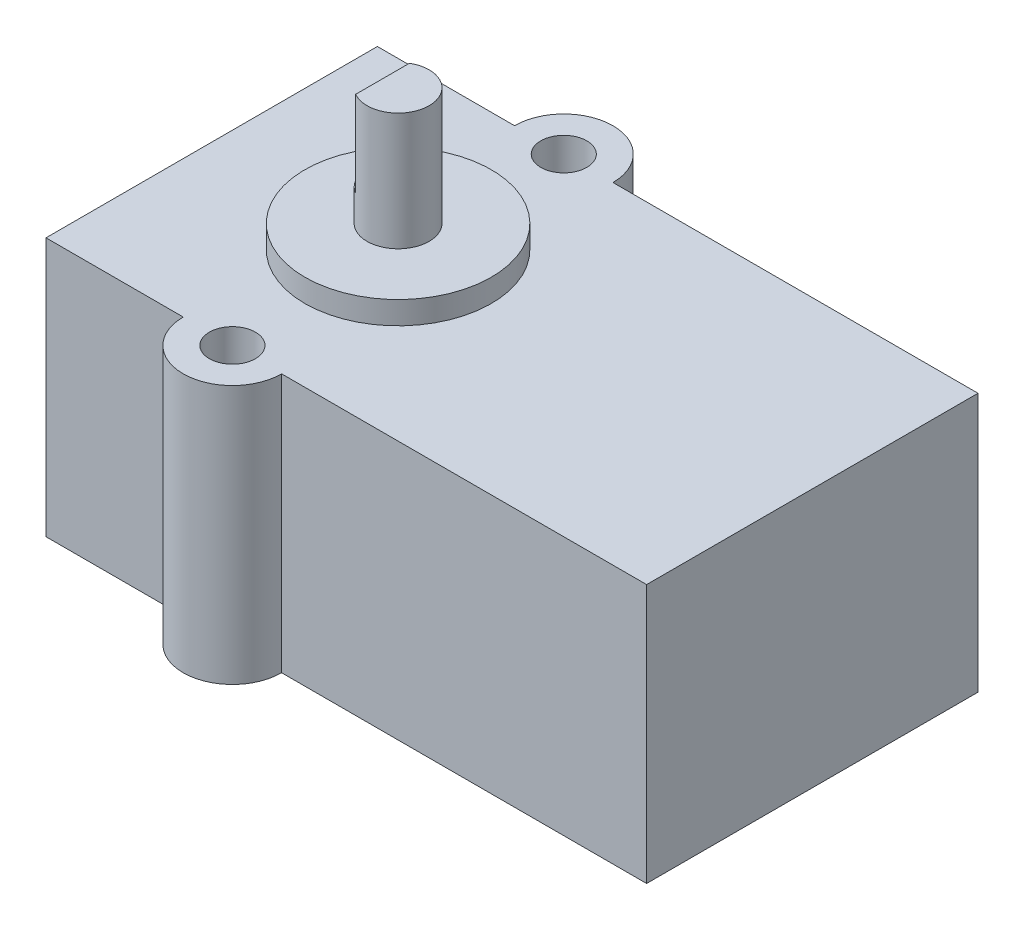
from build123d import *

# Parameters (mm, degrees)
SKETCH1_R           = 2.225
BOSS_EXTRUDE1_DEPTH = 25
SKETCH2_R           = 9
BOSS_EXTRUDE2_DEPTH = 2.2
SKETCH3_R           = 3
BOSS_EXTRUDE3_DEPTH = 11.35
SKETCH4_W           = 1.5
SKETCH4_H           = 6
CUT_EXTRUDE1_DEPTH  = 8.3


with BuildPart() as part:
    # Sketch1 → Boss-Extrude1 (new body)
    with BuildSketch(Plane(origin=(0, 0, 0), x_dir=(1, 0, 0), z_dir=(0, 1, 0))):
        with BuildLine():
            Line((-5.75, -16), (-19, -16))
            Line((-19, -16), (-19, 16))
            Line((-19, 16), (-5.75, 16))
            ThreePointArc((-5.75, 16), (-1, 20.75), (3.75, 16))
            Line((3.75, 16), (39, 16))
            Line((39, 16), (39, -16))
            Line((39, -16), (3.75, -16))
            ThreePointArc((3.75, -16), (-1, -20.75), (-5.75, -16))
        make_face()
        with Locations(Location((-1, -16, 0), (0, 0, 270))):
            Circle(SKETCH1_R, mode=Mode.SUBTRACT)
        with Locations(Location((-1, 16, 0), (0, 0, 90))):
            Circle(SKETCH1_R, mode=Mode.SUBTRACT)
    extrude(amount=BOSS_EXTRUDE1_DEPTH)

    # Sketch2 → Boss-Extrude2 (add)
    with BuildSketch(Plane(origin=(0, 25, 0), x_dir=(1, 0, 0), z_dir=(0, 1, 0))):
        with Locations(Location((-1, 0, 0), (0, 0, 270))):
            Circle(SKETCH2_R)
    extrude(amount=BOSS_EXTRUDE2_DEPTH)

    # Sketch3 → Boss-Extrude3 (add)
    with BuildSketch(Plane(origin=(0, 27.2, 0), x_dir=(1, 0, 0), z_dir=(0, 1, 0))):
        with Locations(Location((-1, 0, 0), (0, 0, 270))):
            Circle(SKETCH3_R)
    extrude(amount=BOSS_EXTRUDE3_DEPTH)

    # Sketch4 → Cut-Extrude1 (cut)
    with BuildSketch(Plane(origin=(0, 38.55, 0), x_dir=(1, 0, 0), z_dir=(0, 1, 0))):
        with Locations((-3.25, 0)):
            Rectangle(SKETCH4_W, SKETCH4_H)
    extrude(amount=-CUT_EXTRUDE1_DEPTH, mode=Mode.SUBTRACT)


solid = part.part
